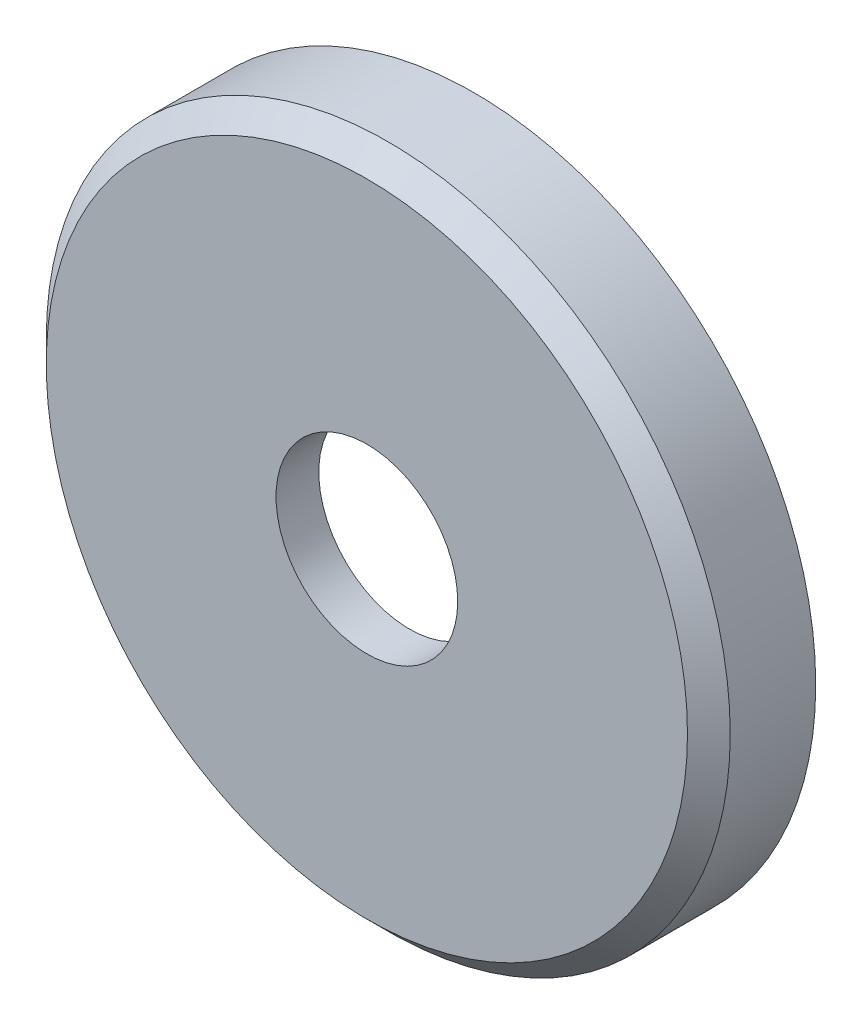
from build123d import *

# Parameters (mm, degrees)
SKETCH1_R           = 16
SKETCH1_R_2         = 12.5
BOSS_EXTRUDE1_DEPTH = 3
SKETCH2_R           = 16
SKETCH2_R_2         = 4.25
BOSS_EXTRUDE2_DEPTH = 2
CHAMFER1_SIZE       = 1


with BuildPart() as part:
    # Sketch1 → Boss-Extrude1 (new body)
    with BuildSketch(Plane.XY):
        Circle(SKETCH1_R)
        Circle(SKETCH1_R_2, mode=Mode.SUBTRACT)
    extrude(amount=BOSS_EXTRUDE1_DEPTH)

    # Sketch2 → Boss-Extrude2 (add)
    with BuildSketch(Plane.XY.offset(3)):
        Circle(SKETCH2_R)
        Circle(SKETCH2_R_2, mode=Mode.SUBTRACT)
    extrude(amount=BOSS_EXTRUDE2_DEPTH)

    # Chamfer1
    chamfer1_edges = [part.edges().sort_by_distance(p)[0] for p in [
        (-16, 0, 5),
    ]]
    chamfer(chamfer1_edges, length=CHAMFER1_SIZE)


solid = part.part
